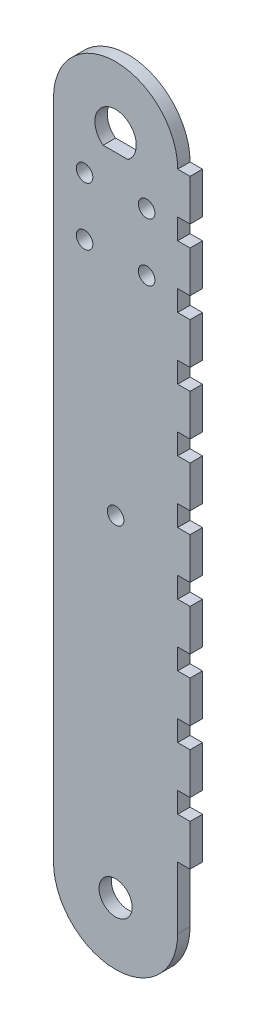
from build123d import *

# Parameters (mm, degrees)
SKETCH_1_R          = 4
SKETCH_1_R_2        = 2
EXTRUDE_1_DEPTH     = 3
SKETCH_3_W          = 3
SKETCH_3_H          = 10
EXTRUDE_4_DEPTH     = 3
SKETCH_4_R          = 2
CUT_EXTRUDE_1_DEPTH = 3


with BuildPart() as part:
    # 草图1 → 凸台-拉伸1 (new body)
    with BuildSketch(Plane.XY):
        with BuildLine():
            Line((-15, 0), (-15, -160))
            ThreePointArc((-15, -160), (0, -175), (15, -160))
            Line((15, -160), (15, 0))
            ThreePointArc((15, 0), (0, 15), (-15, 0))
        make_face()
        with Locations((0, -160)):
            Circle(SKETCH_1_R, mode=Mode.SUBTRACT)
        with Locations((-7.5, -12)):
            Circle(SKETCH_1_R_2, mode=Mode.SUBTRACT)
        with Locations((-7.5, -26)):
            Circle(SKETCH_1_R_2, mode=Mode.SUBTRACT)
        with Locations(Location((7.5, -26, 0), (0, 0, 180))):
            Circle(SKETCH_1_R_2, mode=Mode.SUBTRACT)
        with Locations(Location((7.5, -12, 0), (0, 0, 180))):
            Circle(SKETCH_1_R_2, mode=Mode.SUBTRACT)
        with BuildLine():
            Line((0, -4), (3, -4))
            ThreePointArc((3, -4), (0, 5), (-3, -4))
            Line((-3, -4), (0, -4))
        make_face(mode=Mode.SUBTRACT)
    extrude(amount=EXTRUDE_1_DEPTH)

    # 草图3 → 凸台-拉伸4 (add)
    with BuildSketch(Plane.XY.offset(3)):
        with Locations((16.5, -5)):
            Rectangle(SKETCH_3_W, SKETCH_3_H)
        with Locations((16.5, -20)):
            Rectangle(SKETCH_3_W, SKETCH_3_H)
        with Locations((16.5, -35)):
            Rectangle(SKETCH_3_W, SKETCH_3_H)
        with Locations((16.5, -50)):
            Rectangle(SKETCH_3_W, SKETCH_3_H)
        with Locations((16.5, -65)):
            Rectangle(SKETCH_3_W, SKETCH_3_H)
        with Locations((16.5, -80)):
            Rectangle(SKETCH_3_W, SKETCH_3_H)
        with Locations((16.5, -95)):
            Rectangle(SKETCH_3_W, SKETCH_3_H)
        with Locations((16.5, -110)):
            Rectangle(SKETCH_3_W, SKETCH_3_H)
        with Locations((16.5, -125)):
            Rectangle(SKETCH_3_W, SKETCH_3_H)
        with Locations((16.5, -140)):
            Rectangle(SKETCH_3_W, SKETCH_3_H)
    extrude(amount=-EXTRUDE_4_DEPTH)

    # 草图4 → 切除-拉伸1 (cut)
    with BuildSketch(Plane.XY.offset(3)):
        with Locations((0, -80)):
            Circle(SKETCH_4_R)
    extrude(amount=-CUT_EXTRUDE_1_DEPTH, mode=Mode.SUBTRACT)


solid = part.part
